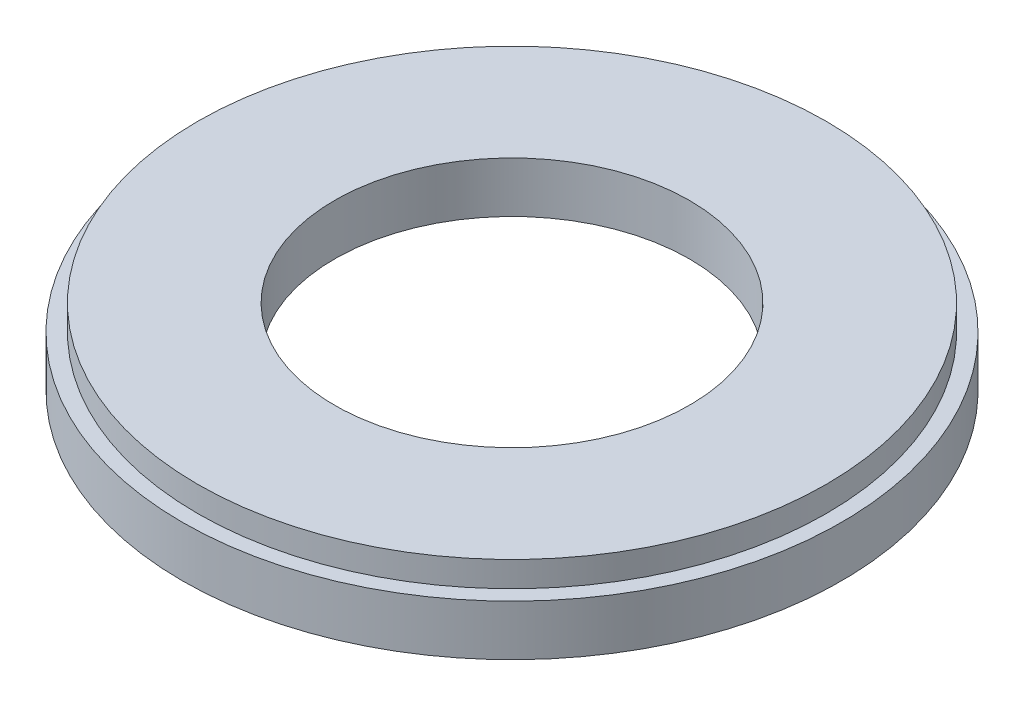
from build123d import *

# Parameters (mm, degrees)
SZKIC1_W = 2
SZKIC1_H = 5


with BuildPart() as part:
    # Szkic1 → Obrót1 (revolve)
    with BuildSketch(Plane.XY, mode=Mode.PRIVATE) as obr_t1_sk:
        Polygon((-63, 0), (-35, 0), (-35, 10), (-62, 10), (-62, 5), (-65, 5), (-65, 0), align=None)
        with Locations((-64, -2.5)):
            Rectangle(SZKIC1_W, SZKIC1_H)
    revolve(obr_t1_sk.sketch.rotate(Axis((0, 0, 0), (0, 1, 0)), 270), axis=Axis((0, 0, 0), (0, 1, 0)))


solid = part.part
